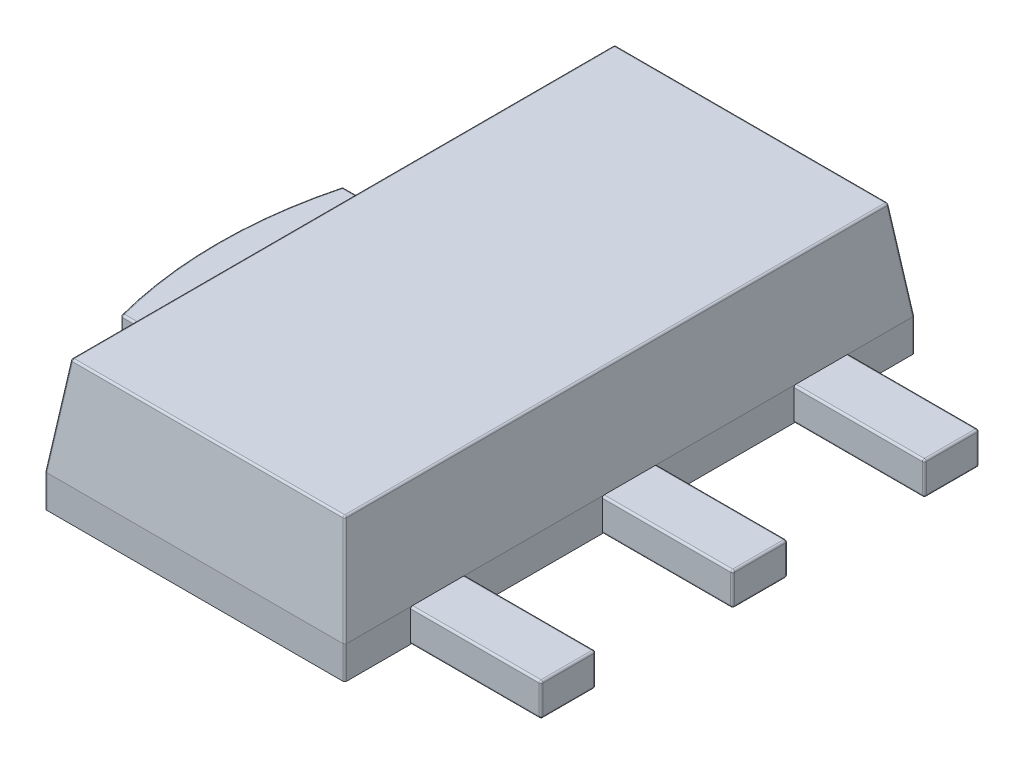
from build123d import *

# Parameters (mm, degrees)
SKETCH1_W           = 2.3
SKETCH1_H           = 4.37
BOSS_EXTRUDE1_DEPTH = 0.5
CUT_EXTRUDE1_DEPTH  = 5.546361182
CUT_EXTRUDE2_DEPTH  = 4.211576716
FILLET1_R           = 0.015
SKETCH6_W           = 1
SKETCH6_H           = 0.42
BOSS_EXTRUDE2_DEPTH = 0.25
FILLET2_R           = 0.015


with BuildPart() as part:
    # Sketch1 → Boss-Extrude1 (new, symmetric)
    with BuildSketch(Plane(origin=(0, 0, 0), x_dir=(1, 0, 0), z_dir=(0, 1, 0))):
        Rectangle(SKETCH1_W, SKETCH1_H)
    extrude(amount=BOSS_EXTRUDE1_DEPTH, both=True)

    # Sketch2 → Cut-Extrude1 (cut, through all)
    with BuildSketch(Plane.XY.offset(2.185)):
        Polygon((-1.15, -0.25), (-1.15, 0.5), (-1.05, 0.5), align=None)
        Polygon((1.05, 0.5), (1.15, -0.25), (1.15, 0.5), align=None)
    extrude(amount=-CUT_EXTRUDE1_DEPTH, mode=Mode.SUBTRACT)

    # Sketch3 → Cut-Extrude2 (cut, through all)
    with BuildSketch(Plane(origin=(1.15, 0, 0), x_dir=(0, 0, -1), z_dir=(1, 0, 0))):
        Polygon((-2.185, -0.25), (-2.185, 0.5), (-2.085, 0.5), align=None)
        Polygon((2.085, 0.5), (2.185, -0.25), (2.185, 0.5), align=None)
    extrude(amount=-CUT_EXTRUDE2_DEPTH, mode=Mode.SUBTRACT)

    # Fillet1
    fillet1_edges = [part.edges().sort_by_distance(p)[0] for p in [
        (1.15, -0.375, 2.185),
        (-1.15, -0.375, 2.185),
        (-1.15, -0.375, -2.185),
        (1.15, -0.375, -2.185),
        (-1.05, 0.5, 0),
        (-1.1, 0.125, -2.135),
        (-1.1, 0.125, 2.135),
        (1.05, 0.5, 0),
        (0, 0.5, 2.085),
        (1.1, 0.125, 2.135),
        (0, 0.5, -2.085),
        (1.1, 0.125, -2.135),
    ]]
    fillet(fillet1_edges, radius=FILLET1_R)

    # Sketch6 → Boss-Extrude2 (add)
    with BuildSketch(Plane.XZ.offset(0.5)):
        with Locations((1.65, 1.47)):
            Rectangle(SKETCH6_W, SKETCH6_H)
        with Locations((1.65, 0)):
            Rectangle(SKETCH6_W, SKETCH6_H)
        with Locations((1.65, -1.47)):
            Rectangle(SKETCH6_W, SKETCH6_H)
        with BuildLine():
            Line((-1.9, 0.85), (-1.15, 0.85))
            Line((-1.15, 0.85), (-1.15, -0.85))
            Line((-1.15, -0.85), (-1.9, -0.85))
            ThreePointArc((-1.9, -0.85), (-2.011348247, 0), (-1.9, 0.85))
        make_face()
    extrude(amount=-BOSS_EXTRUDE2_DEPTH)

    # Fillet2
    fillet2_edges = [part.edges().sort_by_distance(p)[0] for p in [
        (-1.525, -0.25, -0.85),
        (-2.011348247, -0.25, 0),
        (-1.9, -0.375, -0.85),
        (-1.525, -0.25, 0.85),
        (-1.9, -0.375, 0.85),
        (-1.525, -0.5, 0.85),
        (-2.011348247, -0.5, 0),
        (-1.525, -0.5, -0.85),
        (1.65, -0.25, 1.68),
        (2.15, -0.25, 1.47),
        (2.15, -0.375, 1.68),
        (1.65, -0.25, 1.26),
        (2.15, -0.375, 1.26),
        (1.65, -0.5, 1.68),
        (1.65, -0.5, 1.26),
        (2.15, -0.5, 1.47),
        (1.65, -0.25, 0.21),
        (2.15, -0.25, 0),
        (2.15, -0.375, 0.21),
        (1.65, -0.25, -0.21),
        (2.15, -0.375, -0.21),
        (1.65, -0.5, 0.21),
        (1.65, -0.5, -0.21),
        (2.15, -0.5, 0),
        (1.65, -0.25, -1.26),
        (2.15, -0.25, -1.47),
        (2.15, -0.375, -1.26),
        (1.65, -0.25, -1.68),
        (2.15, -0.375, -1.68),
        (1.65, -0.5, -1.26),
        (1.65, -0.5, -1.68),
        (2.15, -0.5, -1.47),
    ]]
    fillet(fillet2_edges, radius=FILLET2_R)


solid = part.part
